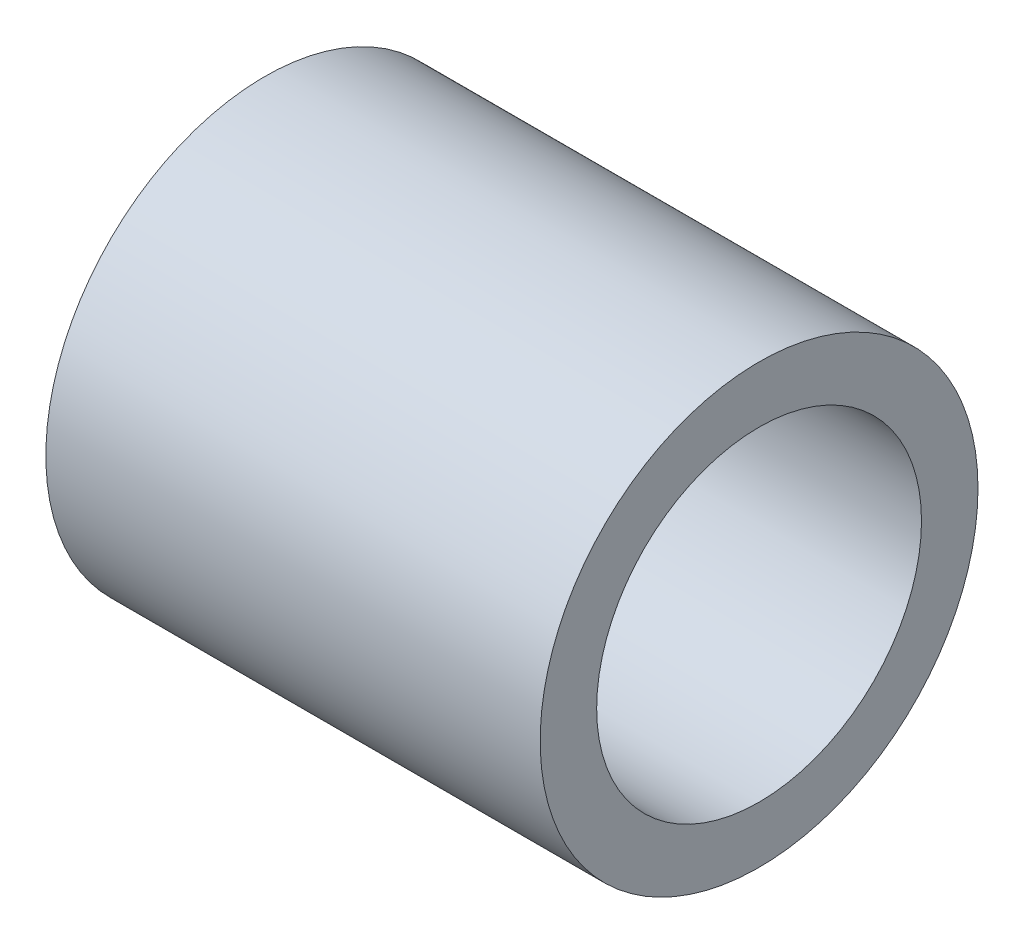
from build123d import *

# Parameters (mm, degrees)
SKETCH2_R           = 9.8425
SKETCH2_R_2         = 7.3025
BOSS_EXTRUDE1_DEPTH = 22.225


with BuildPart() as part:
    # Sketch2 → Boss-Extrude1 (new body)
    with BuildSketch(Plane(origin=(0, 0, 0), x_dir=(0, 0, -1), z_dir=(1, 0, 0))):
        Circle(SKETCH2_R)
        Circle(SKETCH2_R_2, mode=Mode.SUBTRACT)
    extrude(amount=BOSS_EXTRUDE1_DEPTH)


solid = part.part
